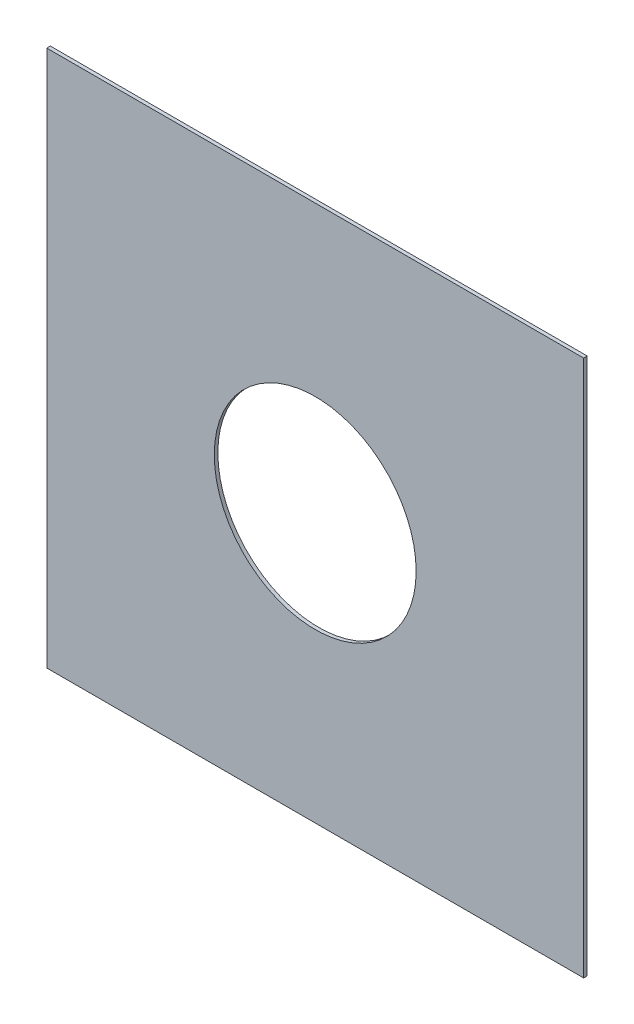
from build123d import *

# Parameters (mm, degrees)
SKETCH1_W           = 38.1
SKETCH1_H           = 38.1
BOSS_EXTRUDE1_DEPTH = 0.254
SKETCH3_R           = 7.1628
CUT_EXTRUDE2_DEPTH  = 27.941965704


with BuildPart() as part:
    # Sketch1 → Boss-Extrude1 (new body)
    with BuildSketch(Plane.XY):
        Rectangle(SKETCH1_W, SKETCH1_H)
    extrude(amount=BOSS_EXTRUDE1_DEPTH)

    # Sketch3 → Cut-Extrude2 (cut, through all)
    with BuildSketch(Plane.XY):
        Circle(SKETCH3_R)
    extrude(amount=CUT_EXTRUDE2_DEPTH, mode=Mode.SUBTRACT)


solid = part.part
